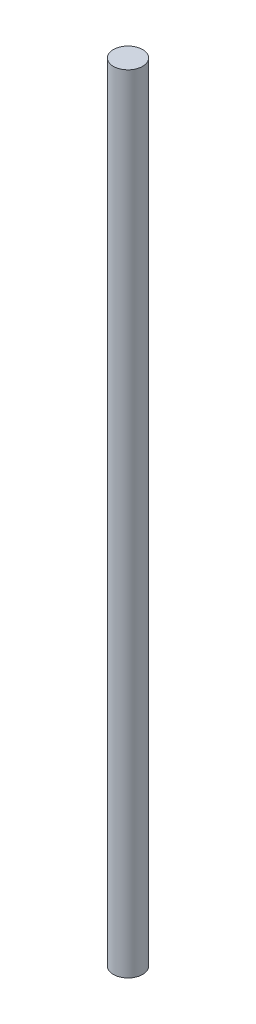
from build123d import *

# Parameters (mm, degrees)
SKETCH1_R           = 7.5
BOSS_EXTRUDE2_DEPTH = 404


with BuildPart() as part:
    # Sketch1 → Boss-Extrude2 (new body)
    with BuildSketch(Plane(origin=(0, 0, 0), x_dir=(1, 0, 0), z_dir=(0, 1, 0))):
        with Locations(Location((0, 0, 0), (0, 0, 270))):
            Circle(SKETCH1_R)
    extrude(amount=BOSS_EXTRUDE2_DEPTH)


solid = part.part
